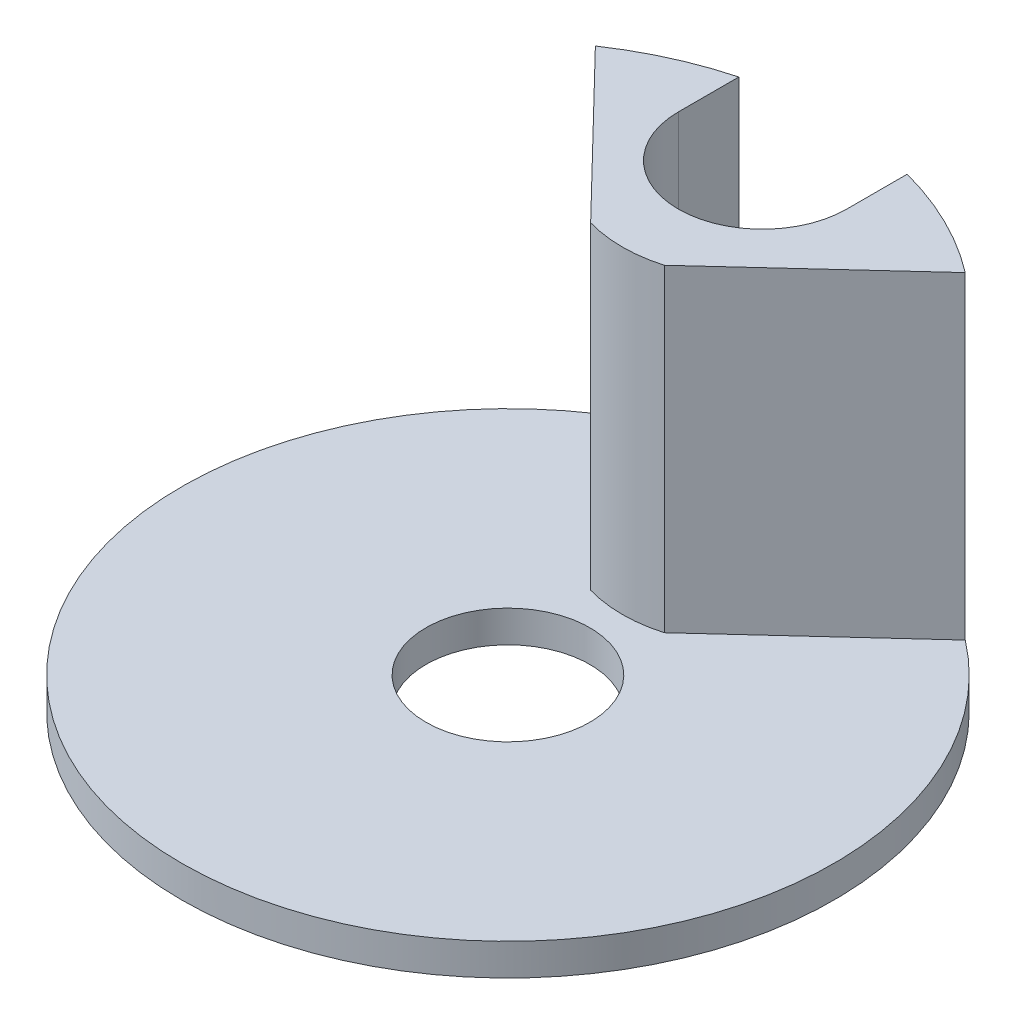
from build123d import *

# Parameters (mm, degrees)
SKETCH1_R           = 20.5
BOSS_EXTRUDE1_DEPTH = 2
SKETCH2_R           = 5.15
CUT_EXTRUDE1_DEPTH  = 3
SKETCH3_R           = 2
CUT_EXTRUDE2_DEPTH  = 2
BOSS_EXTRUDE4_DEPTH = 20


with BuildPart() as part:
    # Sketch1 → Boss-Extrude1 (new body)
    with BuildSketch(Plane(origin=(0, 0, 0), x_dir=(1, 0, 0), z_dir=(0, 1, 0))):
        with Locations(Location((0, 0, 0), (0, 0, 270))):
            Circle(SKETCH1_R)
    extrude(amount=BOSS_EXTRUDE1_DEPTH)

    # Sketch2 → Cut-Extrude1 (cut)
    with BuildSketch(Plane(origin=(0, 2, 0), x_dir=(1, 0, 0), z_dir=(0, 1, 0))):
        with Locations(Location((0, 0, 0), (0, 0, 270))):
            Circle(SKETCH2_R)
    extrude(amount=-CUT_EXTRUDE1_DEPTH, mode=Mode.SUBTRACT)

    # Sketch3 → Cut-Extrude2 (cut)
    with BuildSketch(Plane(origin=(0, 2, 0), x_dir=(1, 0, 0), z_dir=(0, 1, 0))):
        with Locations(Location((0, 16, 0), (0, 0, 270))):
            Circle(SKETCH3_R)
    extrude(amount=-CUT_EXTRUDE2_DEPTH, mode=Mode.SUBTRACT)

    # Sketch4 → Boss-Extrude4 (add)
    with BuildSketch(Plane(origin=(0, 2, 0), x_dir=(1, 0, 0), z_dir=(0, 1, 0))):
        with BuildLine():
            Line((-2.014609667, 7.214480564), (-11.484686708, 16.980929633))
            ThreePointArc((-11.484686708, 16.980929633), (-8.505321904, 18.650308428), (-5.290322683, 19.802358863))
            Line((-5.290322683, 19.802358863), (-5.290322683, 16))
            ThreePointArc((-5.290322683, 16), (0, 10.709677317), (5.290322683, 16))
            Line((5.290322683, 16), (5.290322683, 19.802019217))
            ThreePointArc((5.290322683, 19.802019217), (9.053928633, 18.389935215), (12.469975936, 16.271130881))
            Line((12.469975936, 16.271130881), (2.613547676, 7.214480564))
            ThreePointArc((2.613547676, 7.214480564), (0.299469005, 6.887955487), (-2.014609667, 7.214480564))
        make_face()
    extrude(amount=BOSS_EXTRUDE4_DEPTH)


solid = part.part
